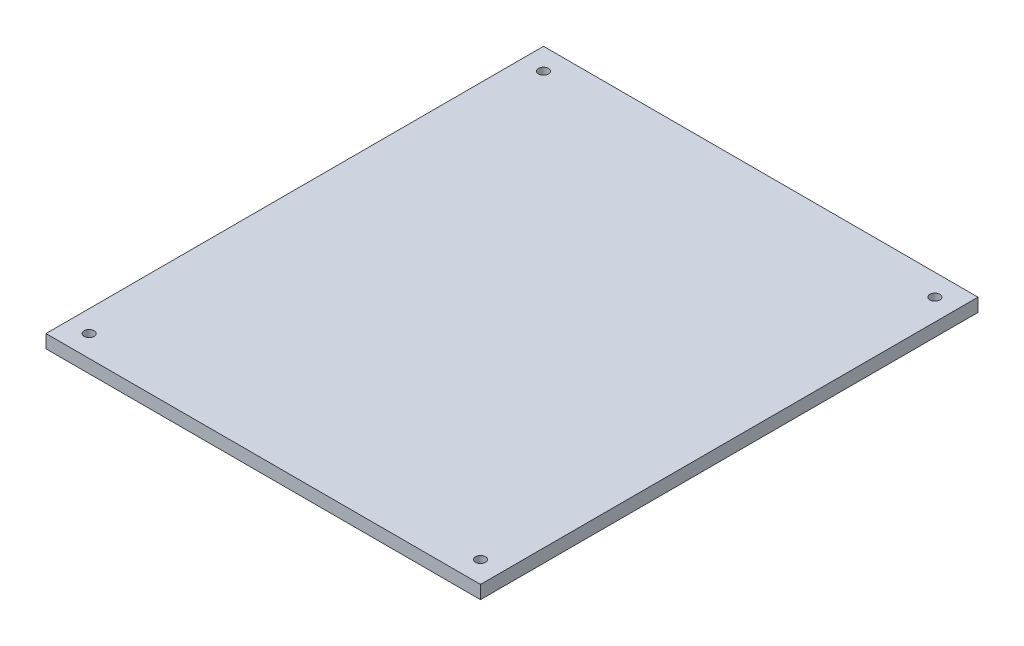
from build123d import *

# Parameters (mm, degrees)
SKETCH1_W           = 131
SKETCH1_H           = 150
SKETCH1_R           = 1.5
BOSS_EXTRUDE1_DEPTH = 4


with BuildPart() as part:
    # Sketch1 → Boss-Extrude1 (new body)
    with BuildSketch(Plane(origin=(0, 0, 0), x_dir=(1, 0, 0), z_dir=(0, 1, 0))):
        Rectangle(SKETCH1_W, SKETCH1_H)
        with Locations(Location((-59, 68.5, 0), (0, 0, 270))):
            Circle(SKETCH1_R, mode=Mode.SUBTRACT)
        with Locations(Location((59, 68.5, 0), (0, 0, 90))):
            Circle(SKETCH1_R, mode=Mode.SUBTRACT)
        with Locations(Location((59, -68.5, 0), (0, 0, 270))):
            Circle(SKETCH1_R, mode=Mode.SUBTRACT)
        with Locations(Location((-59, -68.5, 0), (0, 0, 90))):
            Circle(SKETCH1_R, mode=Mode.SUBTRACT)
    extrude(amount=BOSS_EXTRUDE1_DEPTH)


solid = part.part
